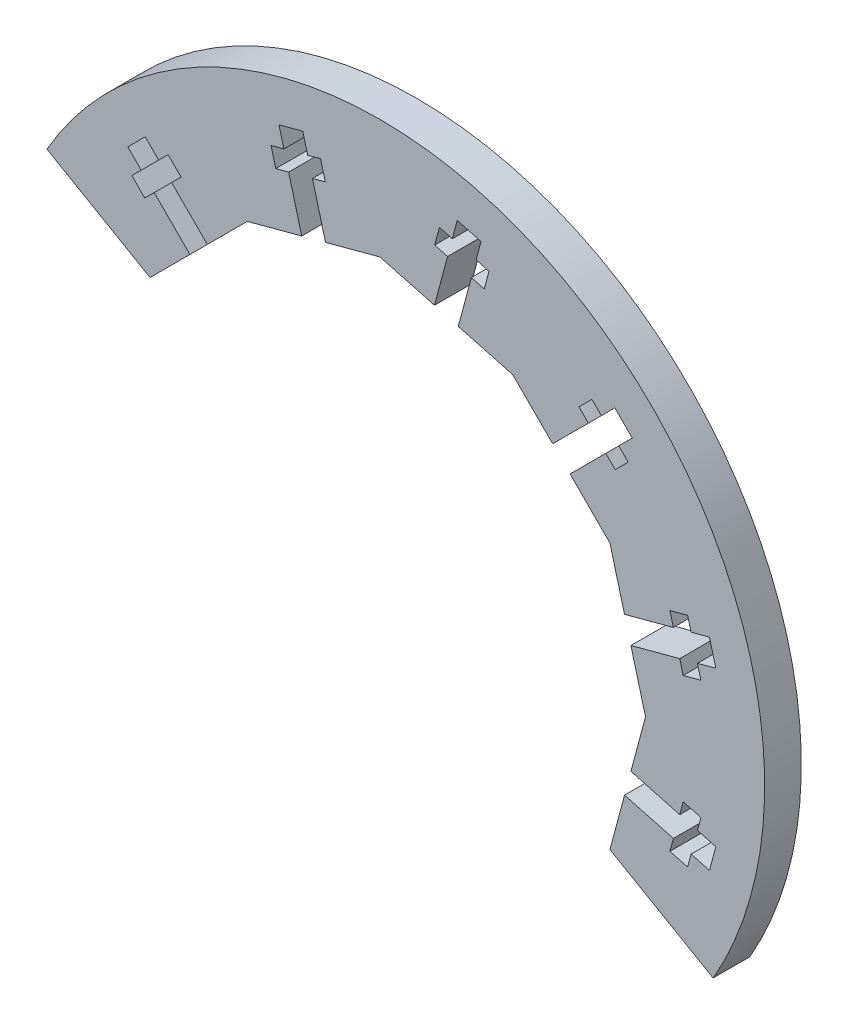
from build123d import *

# Parameters (mm, degrees)
SKETCH1_R           = 66.675
BOSS_EXTRUDE1_DEPTH = 6.35
CUT_EXTRUDE1_DEPTH  = 95.50626302
CIRPATTERN1_COUNT   = 6
CIRPATTERN1_ANGLE   = 150
CUT_EXTRUDE2_START  = -6.35
CUT_EXTRUDE2_DEPTH  = 6.35


with BuildPart() as part:
    # Sketch1 → Boss-Extrude1 (new body)
    with BuildSketch(Plane.XY):
        Circle(SKETCH1_R)
        Polygon((0, 46.018026219), (-23.00901311, 39.852779738), (-39.852779738, 23.00901311), (-46.018026219, 0), (-39.852779738, -23.00901311), (-23.00901311, -39.852779738), (0, -46.018026219), (23.00901311, -39.852779738), (39.852779738, -23.00901311), (46.018026219, 0), (39.852779738, 23.00901311), (23.00901311, 39.852779738), align=None, mode=Mode.SUBTRACT)
    extrude(amount=-BOSS_EXTRUDE1_DEPTH)

    # Sketch2 → Cut-Extrude1 (cut, through all)
    with BuildSketch(Plane.XY):
        Polygon((43.487619293, -9.443607212), (42.383186664, -13.565405898), (50.84759468, -15.83343719), (50.249360339, -18.066078145), (53.316174837, -18.887828613), (53.914409178, -16.655187658), (57.103896257, -17.509808145), (58.208328886, -13.388009459), (55.018841807, -12.533388972), (55.617076148, -10.300748017), (52.55026165, -9.478997549), (51.952027309, -11.711638504), align=None)
    cut_extrude1 = extrude(amount=-CUT_EXTRUDE1_DEPTH, mode=Mode.SUBTRACT)

    # CirPattern1: Cut-Extrude1 ×6 about axis
    cirpattern1_axis = Axis((0, 0, 0), (0, 0, 1))
    for i in range(1, CIRPATTERN1_COUNT):
        add(cut_extrude1.rotate(cirpattern1_axis, i * CIRPATTERN1_ANGLE / (CIRPATTERN1_COUNT - 1)), mode=Mode.SUBTRACT)

    # Sketch3 → Cut-Extrude2 (cut)
    with BuildSketch(Plane(origin=(0, 0, -6.35), x_dir=(-1, 0, 0), z_dir=(0, 0, -1)).offset(CUT_EXTRUDE2_START)):
        with BuildLine():
            Line((-39.852779738, -23.00901311), (-57.742243797, -33.3375))
            ThreePointArc((-57.742243797, -33.3375), (17.256759832, -64.403104468), (66.675, 0))
            ThreePointArc((66.675, 0), (64.403104468, 17.256759832), (57.742243797, 33.3375))
            Line((57.742243797, 33.3375), (39.852779738, 23.00901311))
            Line((39.852779738, 23.00901311), (46.018026219, 0))
            Line((46.018026219, 0), (39.852779738, -23.00901311))
            Line((39.852779738, -23.00901311), (23.00901311, -39.852779738))
            Line((23.00901311, -39.852779738), (0, -46.018026219))
            Line((0, -46.018026219), (-23.00901311, -39.852779738))
            Line((-23.00901311, -39.852779738), (-39.852779738, -23.00901311))
        make_face()
    extrude(amount=CUT_EXTRUDE2_DEPTH, mode=Mode.SUBTRACT)


solid = part.part
